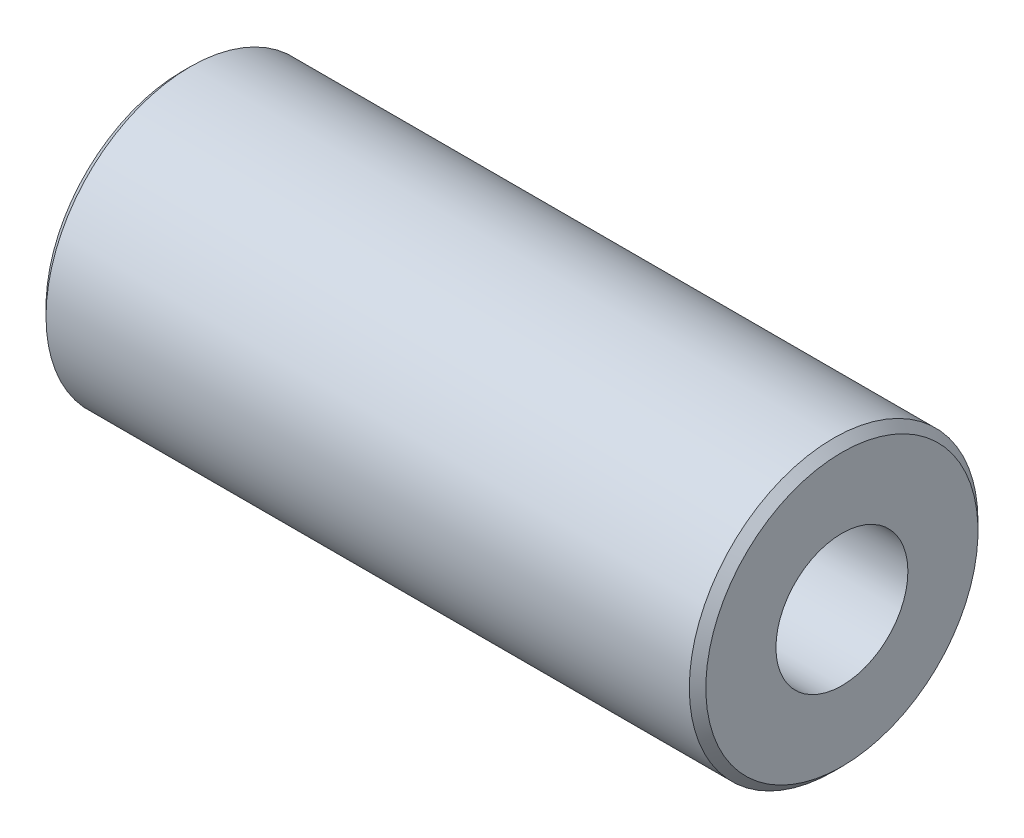
from build123d import *

# Parameters (mm, degrees)
SKETCH_1_W     = 8
SKETCH_1_H     = 1.75
CHAMFER_1_SIZE = 0.1


with BuildPart() as part:
    # 草图1 → 旋转1 (revolve)
    with BuildSketch(Plane.XY, mode=Mode.PRIVATE) as revolve_1_sk:
        with Locations((0, 0.875)):
            Rectangle(SKETCH_1_W, SKETCH_1_H)
    revolve(revolve_1_sk.sketch.rotate(Axis((-4, 0, 0), (1, 0, 0)), 180), axis=Axis((-4, 0, 0), (1, 0, 0)))

    # 草图3 → Hole Wizard 381 (revolve, cut)
    with BuildSketch(Plane(origin=(-4, 0, 0), x_dir=(0, 0, 1), z_dir=(0, 1, 0))):
        Polygon((0, 0), (0, 6.480688495), (0.8, 6), (0.8, 0), align=None)
    hole_wizard_381 = revolve(axis=Axis((-10.35, 0, 0), (1, 0, 0)), mode=Mode.SUBTRACT)

    # 镜向1: Hole Wizard 381 across plane
    add(hole_wizard_381.mirror(Plane(origin=(0, 0, 0), x_dir=(0, 0, 1), z_dir=(1, 0, 0))), mode=Mode.SUBTRACT)

    # 倒角1
    chamfer_1_edges = [part.edges().sort_by_distance(p)[0] for p in [
        (-4, 1.75, 0),
        (4, 1.75, 0),
    ]]
    chamfer(chamfer_1_edges, length=CHAMFER_1_SIZE)


solid = part.part
